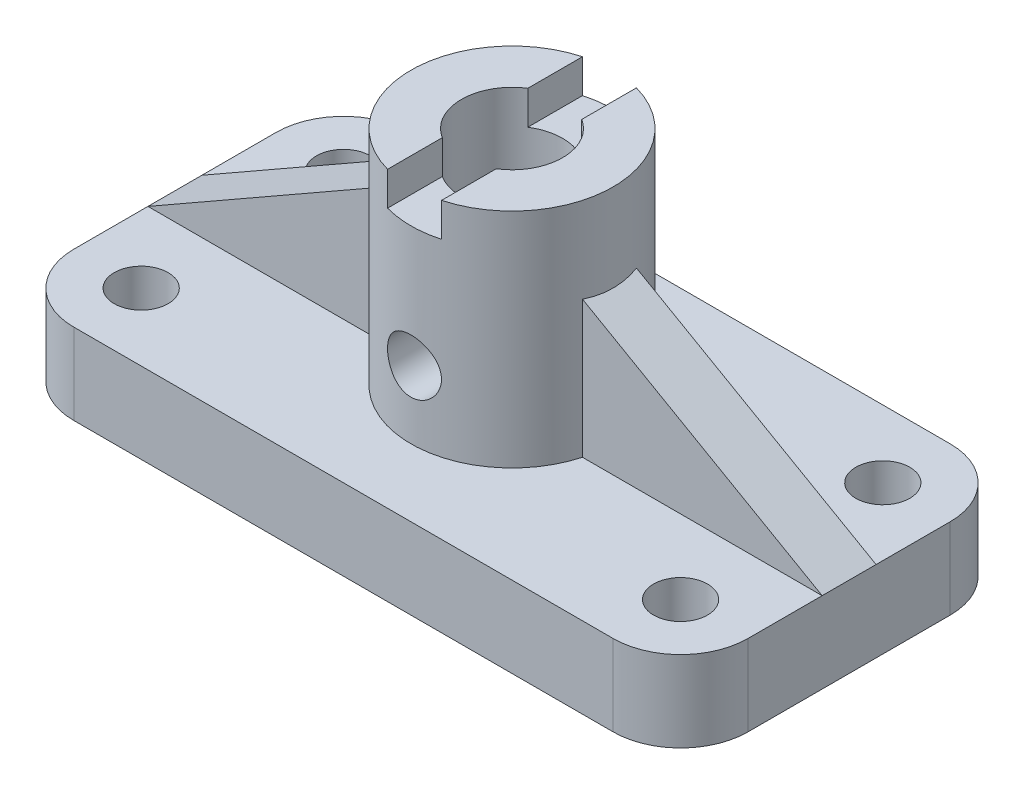
from build123d import *

# Parameters (mm, degrees)
SKETCH_1_R               = 4
EXTRUDE_1_DEPTH          = 12
SKETCH_2_R               = 15
SKETCH_2_R_2             = 7.5
EXTRUDE_2_DEPTH          = 33
CUT_EXTRUDE_1_DEPTH      = 65.915329468
CUT_EXTRUDE_1_DEPTH_BACK = 65.915329468
SKETCH_4_R               = 7.5
RIB_1_REACH              = 73.764
SKETCH_5_WALL_W          = 185.838289686
SKETCH_5_WALL_H          = 8
CUT_EXTRUDE_2_DEPTH      = 72.763500472
CUT_EXTRUDE_2_DEPTH_BACK = 72.763500472
SKETCH_8_W               = 8
SKETCH_8_H               = 5
CUT_EXTRUDE_3_DEPTH      = 72.763500472
CUT_EXTRUDE_3_DEPTH_BACK = 72.763500472
SKETCH_9_R               = 4


with BuildPart() as part:
    # 草图1 → 凸台-拉伸1 (new body)
    with BuildSketch(Plane(origin=(0, 0, 0), x_dir=(1, 0, 0), z_dir=(0, 1, 0))):
        with BuildLine():
            Line((-40, -25), (40, -25))
            ThreePointArc((40, -25), (47.071067812, -22.071067812), (50, -15))
            Line((50, -15), (50, 15))
            ThreePointArc((50, 15), (47.071067812, 22.071067812), (40, 25))
            Line((40, 25), (-40, 25))
            ThreePointArc((-40, 25), (-47.071067812, 22.071067812), (-50, 15))
            Line((-50, 15), (-50, -15))
            ThreePointArc((-50, -15), (-47.071067812, -22.071067812), (-40, -25))
        make_face()
        with Locations(Location((-40, 15, 0), (0, 0, 270))):
            Circle(SKETCH_1_R, mode=Mode.SUBTRACT)
        with Locations(Location((-40, -15, 0), (0, 0, 270))):
            Circle(SKETCH_1_R, mode=Mode.SUBTRACT)
        with Locations(Location((40, -15, 0), (0, 0, 270))):
            Circle(SKETCH_1_R, mode=Mode.SUBTRACT)
        with Locations(Location((40, 15, 0), (0, 0, 270))):
            Circle(SKETCH_1_R, mode=Mode.SUBTRACT)
    extrude(amount=EXTRUDE_1_DEPTH)

    # 草图2 → 凸台-拉伸2 (add)
    with BuildSketch(Plane(origin=(0, 12, 0), x_dir=(1, 0, 0), z_dir=(0, 1, 0))):
        with Locations(Location((0, 0, 0), (0, 0, 90))):
            Circle(SKETCH_2_R)
        with Locations(Location((0, 0, 0), (0, 0, 270))):
            Circle(SKETCH_2_R_2, mode=Mode.SUBTRACT)
    extrude(amount=EXTRUDE_2_DEPTH)

    # 草图4 → 切除-拉伸1 (cut, two sides: drawn at the far end of the back side and taken through both)
    with BuildSketch(Plane(origin=(0, 12, 0), x_dir=(1, 0, 0), z_dir=(0, 1, 0)).offset(-CUT_EXTRUDE_1_DEPTH_BACK)):
        with Locations(Location((0, 0, 0), (0, 0, 270))):
            Circle(SKETCH_4_R)
    extrude(amount=CUT_EXTRUDE_1_DEPTH + CUT_EXTRUDE_1_DEPTH_BACK, mode=Mode.SUBTRACT)

    # 草图5 wall → 筋1 (add, up to next)
    with BuildSketch(Plane(origin=(-32.5, 22, 0), x_dir=(0.868243142124, 0.496138938357, 0), z_dir=(-0.496138938357, 0.868243142124, 0)), mode=Mode.PRIVATE) as rib_1_sk1:
        Rectangle(SKETCH_5_WALL_W, SKETCH_5_WALL_H)
    rib_1_tool1 = extrude(rib_1_sk1.sketch, amount=-RIB_1_REACH, mode=Mode.PRIVATE) - part.part
    rib_1 = rib_1_tool1.solids().sort_by_distance((-32.5, 22, 0))[0]
    add(rib_1)

    # 镜向1: 筋1 across plane
    add(rib_1.mirror(Plane(origin=(0, 0, 0), x_dir=(0, 0, 1), z_dir=(1, 0, 0))))

    # 草图8 → 切除-拉伸2 (cut, two sides: drawn at the far end of the back side and taken through both)
    with BuildSketch(Plane.XY.offset(-CUT_EXTRUDE_2_DEPTH_BACK)):
        with Locations((0, 42.5)):
            Rectangle(SKETCH_8_W, SKETCH_8_H)
    extrude(amount=CUT_EXTRUDE_2_DEPTH + CUT_EXTRUDE_2_DEPTH_BACK, mode=Mode.SUBTRACT)

    # 草图9 → 切除-拉伸3 (cut, two sides: drawn at the far end of the back side and taken through both)
    with BuildSketch(Plane.XY.offset(-CUT_EXTRUDE_3_DEPTH_BACK)):
        with Locations((0, 22)):
            Circle(SKETCH_9_R)
    extrude(amount=CUT_EXTRUDE_3_DEPTH + CUT_EXTRUDE_3_DEPTH_BACK, mode=Mode.SUBTRACT)


solid = part.part
